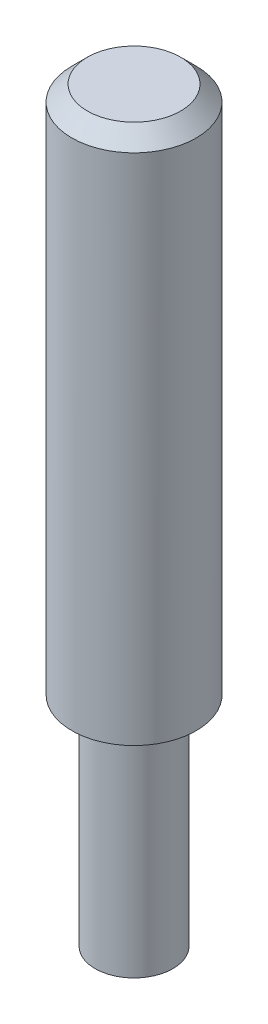
from build123d import *

# Parameters (mm, degrees)
SKETCH2_R           = 4
BOSS_EXTRUDE1_DEPTH = 24
CUT_EXTRUDE1_START  = -14
SKETCH3_R           = 4
SKETCH3_R_2         = 2.5
CUT_EXTRUDE1_DEPTH  = 14
CHAMFER1_SIZE       = 1


with BuildPart() as part:
    # Sketch2 → Boss-Extrude1 (new, symmetric)
    with BuildSketch(Plane(origin=(0, 0, 0), x_dir=(1, 0, 0), z_dir=(0, 1, 0))):
        with Locations(Location((0, 0, 0), (0, 0, 270))):
            Circle(SKETCH2_R)
    extrude(amount=BOSS_EXTRUDE1_DEPTH, both=True)

    # Sketch3 → Cut-Extrude1 (cut)
    with BuildSketch(Plane.XZ.offset(24).offset(CUT_EXTRUDE1_START)):
        with Locations(Location((0, 0, 0), (0, 0, 270))):
            Circle(SKETCH3_R)
        with Locations(Location((0, 0, 0), (0, 0, 270))):
            Circle(SKETCH3_R_2, mode=Mode.SUBTRACT)
    extrude(amount=CUT_EXTRUDE1_DEPTH, mode=Mode.SUBTRACT)

    # Chamfer1
    chamfer1_edges = [part.edges().sort_by_distance(p)[0] for p in [
        (0, 24, -4),
    ]]
    chamfer(chamfer1_edges, length=CHAMFER1_SIZE)


solid = part.part
